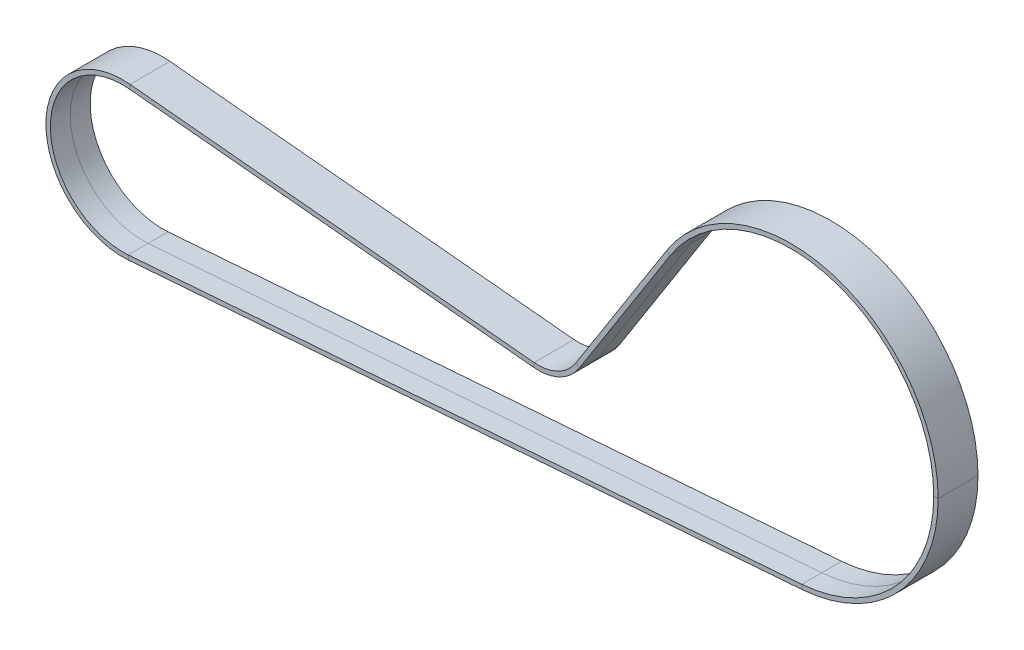
from build123d import *


with BuildPart() as part:
    # Sweep1: sweep along a path in Sketch2
    with BuildLine(Plane.XY) as sweep1_path:
        Line((2.459788124, -32.166085282), (-149.640466326, -43.797416737))
        ThreePointArc((-149.640466326, -43.797416737), (-167.230963528, -27.339263039), (-149.320184824, -11.230246272))
        Line((-149.320184824, -11.230246272), (-58.083261257, -20.015194383))
        ThreePointArc((-58.083261257, -20.015194383), (-52.202583099, -18.950464372), (-47.746530099, -14.968050876))
        Line((-47.746530099, -14.968050876), (-27.222888137, 17.309591604))
        ThreePointArc((-27.222888137, 17.309591604), (27.663395153, 16.596510736), (2.459788124, -32.166085282))
    # Sketch3 → Sweep1 (sweep)
    with BuildSketch(Plane(origin=(0, 0, 0), x_dir=(1, 0, 0), z_dir=(0, 1, 0))):
        Polygon((32.26, 0), (32.26, -4.5), (33.26, -4.5), (33.26, 4.5), (32.26, 4.5), align=None)
    sweep(path=sweep1_path.line)


solid = part.part
